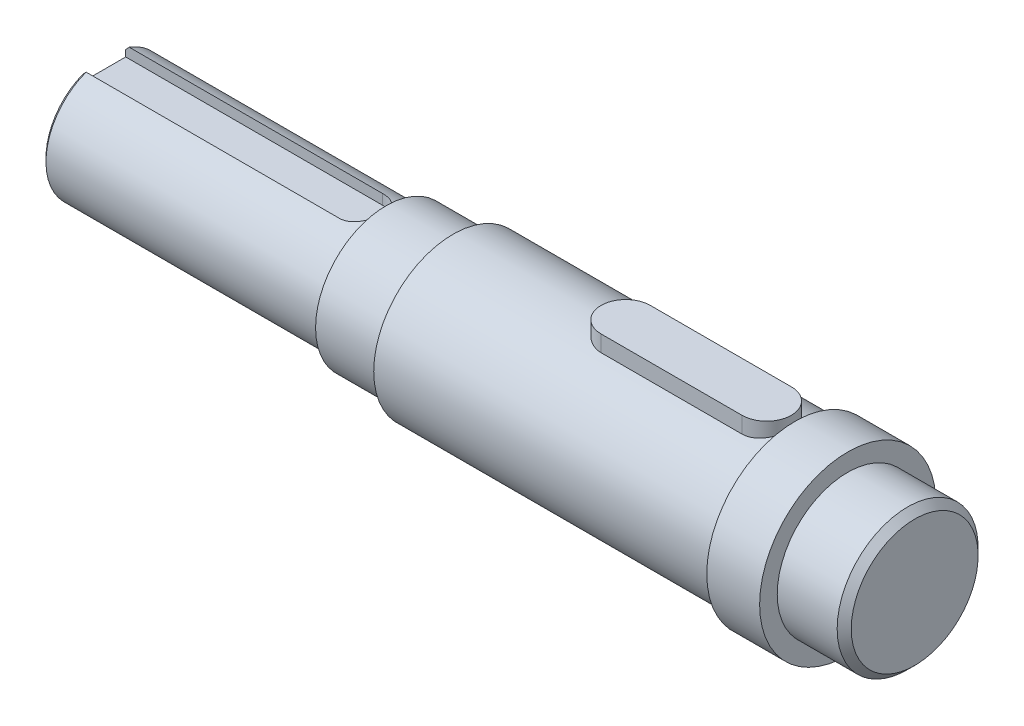
from build123d import *

# Parameters (mm, degrees)
CHAMFER1_SIZE       = 1
CHAMFER2_SIZE       = 1
CHAMFER3_SIZE       = 2
CUT_EXTRUDE1_START  = 17.5
CUT_EXTRUDE1_DEPTH  = 4
CUT_EXTRUDE2_START  = 22.5
CUT_EXTRUDE2_DEPTH  = 5.5
BOSS_EXTRUDE1_DEPTH = 9


with BuildPart() as part:
    # Sketch1 → Revolve1 (revolve)
    with BuildSketch(Plane.XY, mode=Mode.PRIVATE) as revolve1_sk:
        Polygon((-63.504203269, 0), (-63.504203269, 17.5), (16.495796731, 17.5), (16.495796731, 20), (35.495796731, 20), (35.495796731, 22.5), (132.495796731, 22.5), (132.495796731, 25), (147.495796731, 25), (147.495796731, 20), (166.495796731, 20), (166.495796731, 0), align=None)
    revolve(revolve1_sk.sketch.rotate(Axis((-82.320263497, 0, 0), (1, 0, 0)), 90), axis=Axis((-82.320263497, 0, 0), (1, 0, 0)))

    # Chamfer1
    chamfer1_edges = [part.edges().sort_by_distance(p)[0] for p in [
        (16.495796731, 0, -17.5),
    ]]
    chamfer(chamfer1_edges, length=CHAMFER1_SIZE)

    # Chamfer2
    chamfer2_edges = [part.edges().sort_by_distance(p)[0] for p in [
        (-63.504203269, 0, -17.5),
    ]]
    chamfer(chamfer2_edges, length=CHAMFER2_SIZE)

    # Chamfer3
    chamfer3_edges = [part.edges().sort_by_distance(p)[0] for p in [
        (166.495796731, 0, -20),
    ]]
    chamfer(chamfer3_edges, length=CHAMFER3_SIZE)

    # Sketch2 → Cut-Extrude1 (cut)
    with BuildSketch(Plane(origin=(0, 0, 0), x_dir=(1, 0, 0), z_dir=(0, 1, 0)).offset(CUT_EXTRUDE1_START)):
        with BuildLine():
            Line((-66.792748613, 6.118017394), (9.377779337, 6.118017394))
            ThreePointArc((9.377779337, 6.118017394), (15.495796731, 0), (9.377779337, -6.118017394))
            Line((9.377779337, -6.118017394), (-66.792748613, -6.118017394))
            ThreePointArc((-66.792748613, -6.118017394), (-72.910766007, 0), (-66.792748613, 6.118017394))
        make_face()
    extrude(amount=-CUT_EXTRUDE1_DEPTH, mode=Mode.SUBTRACT)

    # Sketch3 → Cut-Extrude2 (cut)
    with BuildSketch(Plane(origin=(0, 0, 0), x_dir=(1, 0, 0), z_dir=(0, 1, 0)).offset(CUT_EXTRUDE2_START)):
        with BuildLine():
            Line((84.495796731, 7), (124.495796731, 7))
            ThreePointArc((124.495796731, 7), (131.495796731, 0), (124.495796731, -7))
            Line((124.495796731, -7), (84.495796731, -7))
            ThreePointArc((84.495796731, -7), (77.495796731, 0), (84.495796731, 7))
        make_face()
    extrude(amount=-CUT_EXTRUDE2_DEPTH, mode=Mode.SUBTRACT)


with BuildPart() as body_2:
    # Sketch4 → Boss-Extrude1 (new body)
    with BuildSketch(Plane(origin=(0, 17, 0), x_dir=(1, 0, 0), z_dir=(0, 1, 0))):
        with BuildLine():
            Line((84.495796731, -7), (124.495796731, -7))
            ThreePointArc((124.495796731, -7), (131.495796731, 0), (124.495796731, 7))
            Line((124.495796731, 7), (84.495796731, 7))
            ThreePointArc((84.495796731, 7), (77.495796731, 0), (84.495796731, -7))
        make_face()
    extrude(amount=BOSS_EXTRUDE1_DEPTH)


solid = Compound([part.part, body_2.part])
